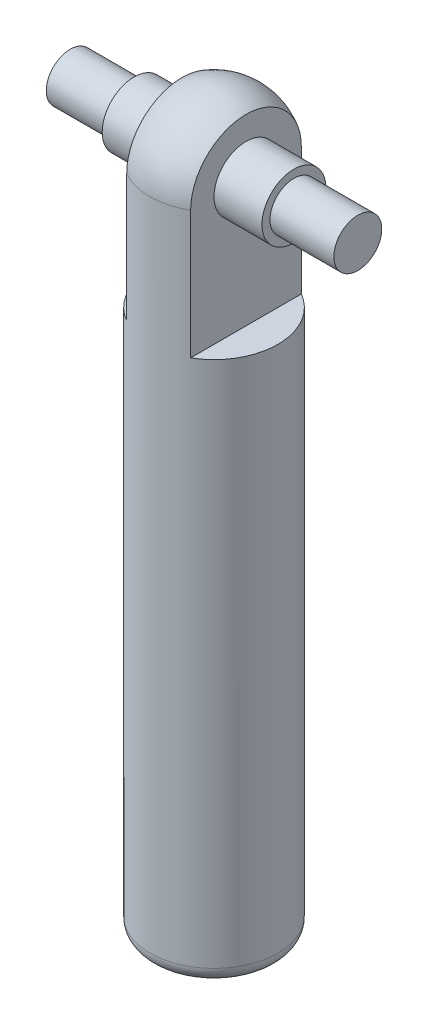
from build123d import *

# Parameters (mm, degrees)
CUT_EXTRUDE1_DEPTH      = 43.3792403
CUT_EXTRUDE1_DEPTH_BACK = 43.3792403
SKETCH3_R               = 2
CUT_EXTRUDE3_START      = -8
CUT_EXTRUDE3_DEPTH      = 12


with BuildPart() as part:
    # Sketch2 → Revolve1 (revolve)
    with BuildSketch(Plane.XY, mode=Mode.PRIVATE) as revolve1_sk:
        with BuildLine():
            Line((4, 0), (4, -41))
            ThreePointArc((4, -41), (3.707106781, -41.707106781), (3, -42))
            Line((3, -42), (0, -42))
            Line((0, -42), (0, 4))
            ThreePointArc((0, 4), (2.828427125, 2.828427125), (4, 0))
        make_face()
    revolve(revolve1_sk.sketch.rotate(Axis((0, -42, 0), (0, 1, 0)), 90), axis=Axis((0, -42, 0), (0, 1, 0)))

    # Sketch3 → Cut-Extrude1 (cut, two sides: drawn at the far end of the back side and taken through both)
    with BuildSketch(Plane(origin=(0, 0, 0), x_dir=(0, 0, -1), z_dir=(1, 0, 0)).offset(-CUT_EXTRUDE1_DEPTH_BACK)):
        Circle(SKETCH3_R)
    extrude(amount=CUT_EXTRUDE1_DEPTH + CUT_EXTRUDE1_DEPTH_BACK, mode=Mode.SUBTRACT)

    # Sketch4 → Cut-Extrude3 (cut)
    with BuildSketch(Plane(origin=(0, 0, 0), x_dir=(1, 0, 0), z_dir=(0, 1, 0)).offset(CUT_EXTRUDE3_START)):
        with BuildLine():
            Line((2, -3.464101615), (2, 3.464101615))
            ThreePointArc((2, 3.464101615), (4, 0), (2, -3.464101615))
        make_face()
        with BuildLine():
            Line((-2, 3.464101615), (-2, -3.464101615))
            ThreePointArc((-2, -3.464101615), (-4, 0), (-2, 3.464101615))
        make_face()
    extrude(amount=CUT_EXTRUDE3_DEPTH, mode=Mode.SUBTRACT)


with BuildPart() as body_2:
    # Sketch5 → Revolve2 (revolve)
    with BuildSketch(Plane.XY, mode=Mode.PRIVATE) as revolve2_sk:
        Polygon((-9, 0), (9, 0), (9, 1.5), (5, 1.5), (5, 2), (-5, 2), (-5, 1.5), (-9, 1.5), align=None)
    revolve(revolve2_sk.sketch.rotate(Axis((-9, 0, 0), (1, 0, 0)), 90), axis=Axis((-9, 0, 0), (1, 0, 0)))


solid = Compound([part.part, body_2.part])
